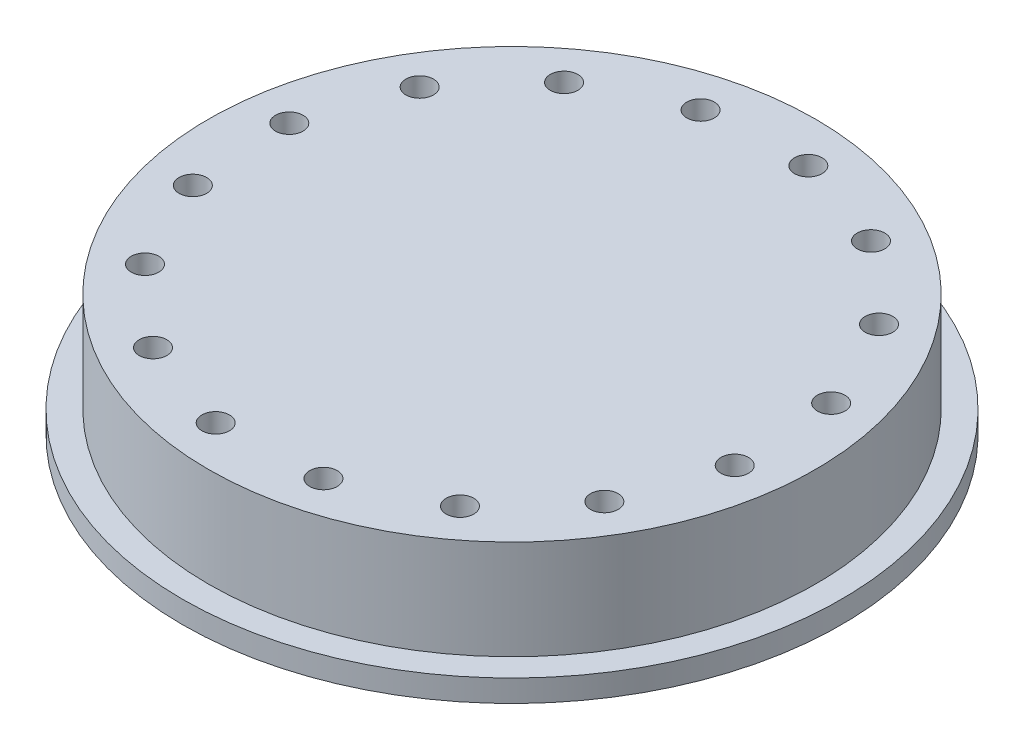
from build123d import *

# Parameters (mm, degrees)
SKETCH1_R               = 29.86111111
BOSS_EXTRUDE1_DEPTH     = 1
SKETCH2_R               = 27.5
BOSS_EXTRUDE2_DEPTH     = 9
CUT_EXTRUDE1_DEPTH      = 44.639109907
CUT_EXTRUDE1_DEPTH_BACK = 44.639109907
SKETCH3_R               = 1.25


with BuildPart() as part:
    # Sketch1 → Boss-Extrude1 (new, symmetric)
    with BuildSketch(Plane(origin=(0, 0, 0), x_dir=(1, 0, 0), z_dir=(0, 1, 0))):
        with Locations(Location((0, 0, 0), (0, 0, 270))):
            Circle(SKETCH1_R)
    extrude(amount=BOSS_EXTRUDE1_DEPTH, both=True)

    # Sketch2 → Boss-Extrude2 (add)
    with BuildSketch(Plane(origin=(0, 1, 0), x_dir=(1, 0, 0), z_dir=(0, 1, 0))):
        with Locations(Location((0, 0, 0), (0, 0, 270))):
            Circle(SKETCH2_R)
    extrude(amount=BOSS_EXTRUDE2_DEPTH)

    # Sketch3 → Cut-Extrude1 (cut, two sides: drawn at the far end of the back side and taken through both)
    with BuildSketch(Plane.XZ.offset(1).offset(-CUT_EXTRUDE1_DEPTH_BACK)):
        with Locations(Location((23.000954051, -5.917652637, 0), (0, 0, 270))):
            Circle(SKETCH3_R)
        with Locations(Location((23.514698299, 3.334885892, 0), (0, 0, 270))):
            Circle(SKETCH3_R)
        with Locations(Location((20.448542892, 12.079718275, 0), (0, 0, 270))):
            Circle(SKETCH3_R)
        with Locations(Location((14.269282196, 18.985523054, 0), (0, 0, 270))):
            Circle(SKETCH3_R)
        with Locations(Location((18.985523054, -14.269282196, 0), (0, 0, 270))):
            Circle(SKETCH3_R)
        with Locations(Location((5.917652637, 23.000954051, 0), (0, 0, 270))):
            Circle(SKETCH3_R)
        with Locations(Location((-3.334885892, 23.514698299, 0), (0, 0, 270))):
            Circle(SKETCH3_R)
        with Locations(Location((-12.079718275, 20.448542892, 0), (0, 0, 270))):
            Circle(SKETCH3_R)
        with Locations(Location((-18.985523054, 14.269282196, 0), (0, 0, 270))):
            Circle(SKETCH3_R)
        with Locations(Location((-23.000954051, 5.917652637, 0), (0, 0, 270))):
            Circle(SKETCH3_R)
        with Locations(Location((-23.514698299, -3.334885892, 0), (0, 0, 270))):
            Circle(SKETCH3_R)
        with Locations(Location((12.079718275, -20.448542892, 0), (0, 0, 270))):
            Circle(SKETCH3_R)
        with Locations(Location((3.334885892, -23.514698299, 0), (0, 0, 270))):
            Circle(SKETCH3_R)
        with Locations(Location((-5.917652637, -23.000954051, 0), (0, 0, 270))):
            Circle(SKETCH3_R)
        with Locations(Location((-14.269282196, -18.985523054, 0), (0, 0, 270))):
            Circle(SKETCH3_R)
        with Locations(Location((-20.448542892, -12.079718275, 0), (0, 0, 270))):
            Circle(SKETCH3_R)
    extrude(amount=CUT_EXTRUDE1_DEPTH + CUT_EXTRUDE1_DEPTH_BACK, mode=Mode.SUBTRACT)


solid = part.part
